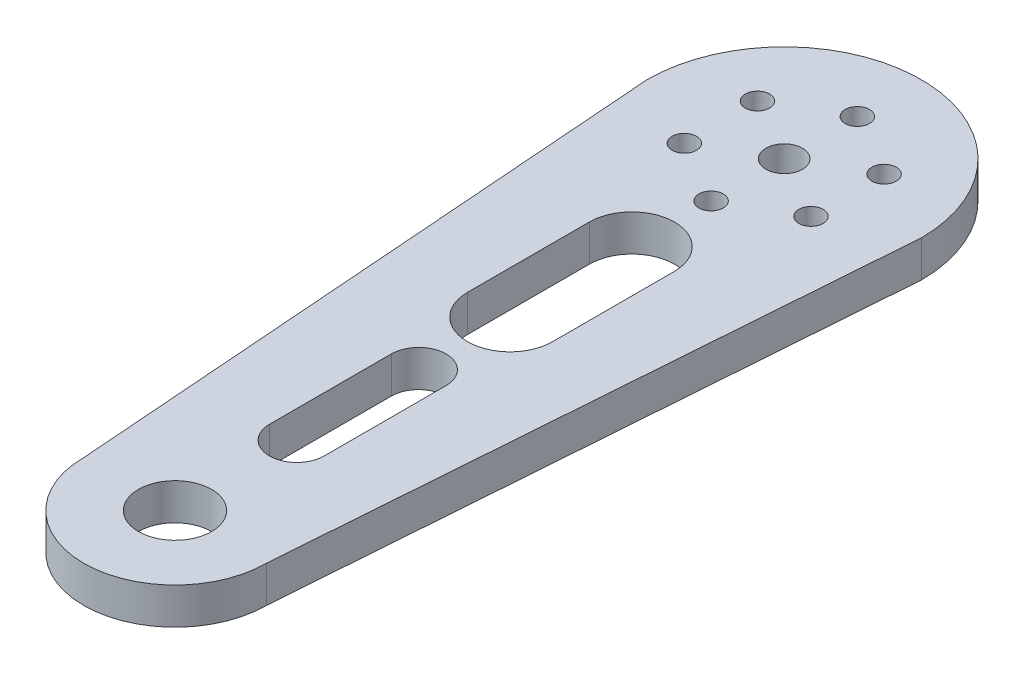
from build123d import *

# Parameters (mm, degrees)
SKETCH_1_R          = 2
SKETCH_1_R_2        = 3
SKETCH_1_R_3        = 6
EXTRUDE_1_DEPTH     = 6
CUT_EXTRUDE_1_DEPTH = 10


with BuildPart() as part:
    # 草图1 → 凸台-拉伸1 (new body)
    with BuildSketch(Plane(origin=(0, 0, 0), x_dir=(1, 0, 0), z_dir=(0, 1, 0))):
        with BuildLine():
            Line((15, -100), (22.5, 0))
            ThreePointArc((22.5, 0), (0, 22.5), (-22.5, 0))
            Line((-22.5, 0), (-15, -100))
            ThreePointArc((-15, -100), (0, -115), (15, -100))
        make_face()
        with Locations(Location((0, 12, 0), (0, 0, 270))):
            Circle(SKETCH_1_R, mode=Mode.SUBTRACT)
        with Locations(Location((10.392304845, 6, 0), (0, 0, 270))):
            Circle(SKETCH_1_R, mode=Mode.SUBTRACT)
        with Locations(Location((10.392304845, -6, 0), (0, 0, 270))):
            Circle(SKETCH_1_R, mode=Mode.SUBTRACT)
        with Locations(Location((0, -12, 0), (0, 0, 270))):
            Circle(SKETCH_1_R, mode=Mode.SUBTRACT)
        with Locations(Location((-10.392304845, -6, 0), (0, 0, 270))):
            Circle(SKETCH_1_R, mode=Mode.SUBTRACT)
        with Locations(Location((-10.392304845, 6, 0), (0, 0, 270))):
            Circle(SKETCH_1_R, mode=Mode.SUBTRACT)
        with Locations(Location((0, 0, 0), (0, 0, 270))):
            Circle(SKETCH_1_R_2, mode=Mode.SUBTRACT)
        with Locations(Location((0, -100, 0), (0, 0, 270))):
            Circle(SKETCH_1_R_3, mode=Mode.SUBTRACT)
    extrude(amount=EXTRUDE_1_DEPTH)

    # 草图2 → 切除-拉伸1 (cut)
    with BuildSketch(Plane(origin=(0, 6, 0), x_dir=(1, 0, 0), z_dir=(0, 1, 0))):
        with BuildLine():
            Line((-4.5, -80), (-4.5, -60))
            ThreePointArc((-4.5, -60), (0, -55.5), (4.5, -60))
            Line((4.5, -60), (4.5, -80))
            ThreePointArc((4.5, -80), (0, -84.5), (-4.5, -80))
        make_face()
        with BuildLine():
            Line((-7, -45), (-7, -25))
            ThreePointArc((-7, -25), (0, -18), (7, -25))
            Line((7, -25), (7, -45))
            ThreePointArc((7, -45), (0, -52), (-7, -45))
        make_face()
    extrude(amount=-CUT_EXTRUDE_1_DEPTH, mode=Mode.SUBTRACT)


solid = part.part
